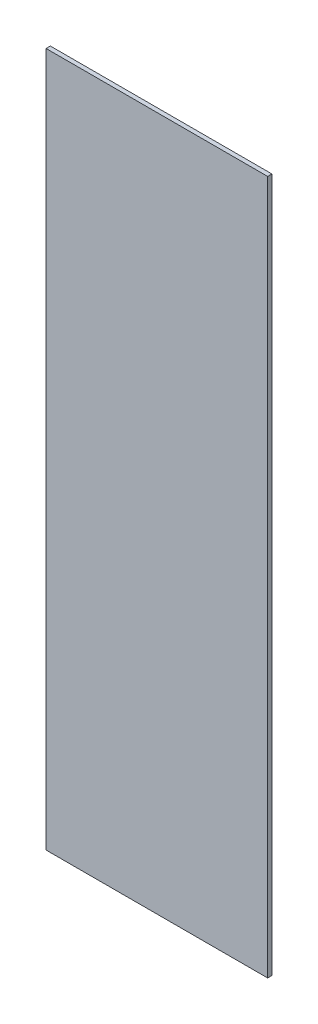
from build123d import *

# Parameters (mm, degrees)
BOSS_EXTRUDE1_DEPTH = 1.6


with BuildPart() as part:
    # Sketch1 → Boss-Extrude1 (new body)
    with BuildSketch(Plane.XY):
        Polygon((-41.5, -50), (-41.5, -110), (41.5, -110), (41.5, -50), (41.5, 50), (41.5, 150), (-41.5, 150), (-41.5, 50), align=None)
    extrude(amount=BOSS_EXTRUDE1_DEPTH)


solid = part.part
